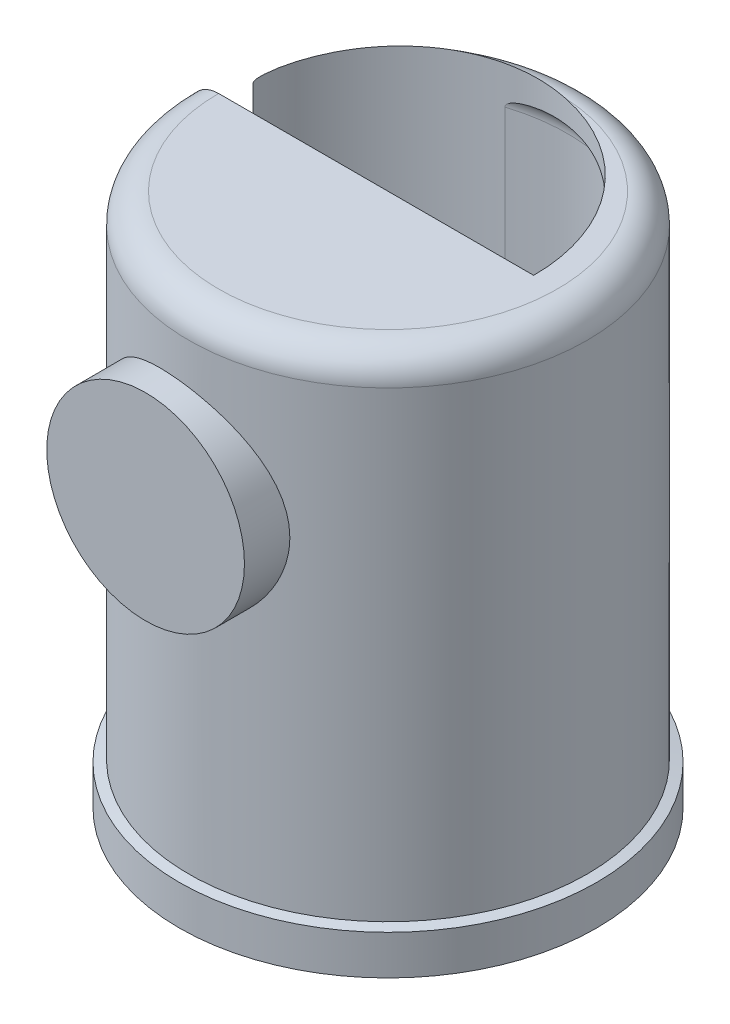
from build123d import *

# Parameters (mm, degrees)
SKETCH4_R           = 10
BOSS_EXTRUDE2_DEPTH = 6
CUT_EXTRUDE2_DEPTH  = 30


with BuildPart() as part:
    # Sketch1 → Revolve1 (revolve)
    with BuildSketch(Plane.XY):
        with BuildLine():
            Line((20.9, 0), (23.871591838, 0))
            Line((23.871591838, 0), (23.871591838, 4))
            Line((23.871591838, 4), (22.9, 4.236662843))
            Line((22.9, 4.236662843), (22.9, 51))
            ThreePointArc((22.9, 51), (22.021320344, 53.121320344), (19.9, 54))
            Line((19.9, 54), (2.764914955, 54))
            Line((2.764914955, 54), (2.764914955, 52))
            Line((2.764914955, 52), (18.9, 52))
            ThreePointArc((18.9, 52), (20.314213562, 51.414213562), (20.9, 50))
            Line((20.9, 50), (20.9, 17))
            Line((20.9, 17), (2.764914955, 17))
            Line((2.764914955, 17), (2.764914955, 15))
            Line((2.764914955, 15), (20.9, 15))
            Line((20.9, 15), (20.9, 0))
        make_face()
    revolve(axis=Axis((2.764914955, 7.821821657, 0), (0, 1, 0)))

    # Sketch4 → Boss-Extrude2 (add)
    with BuildSketch(Plane.XY.offset(22.9)):
        with Locations((1.144629865, 37)):
            Circle(SKETCH4_R)
    extrude(amount=-BOSS_EXTRUDE2_DEPTH)

    # Sketch9 → Cut-Extrude2 (cut)
    with BuildSketch(Plane(origin=(0, 54, 0), x_dir=(1, 0, 0), z_dir=(0, 1, 0))):
        with BuildLine():
            Line((-17.5, 0), (17.5, 0))
            ThreePointArc((17.5, 0), (0, 17.5), (-17.5, 0))
        make_face()
    extrude(amount=-CUT_EXTRUDE2_DEPTH, mode=Mode.SUBTRACT)


solid = part.part
